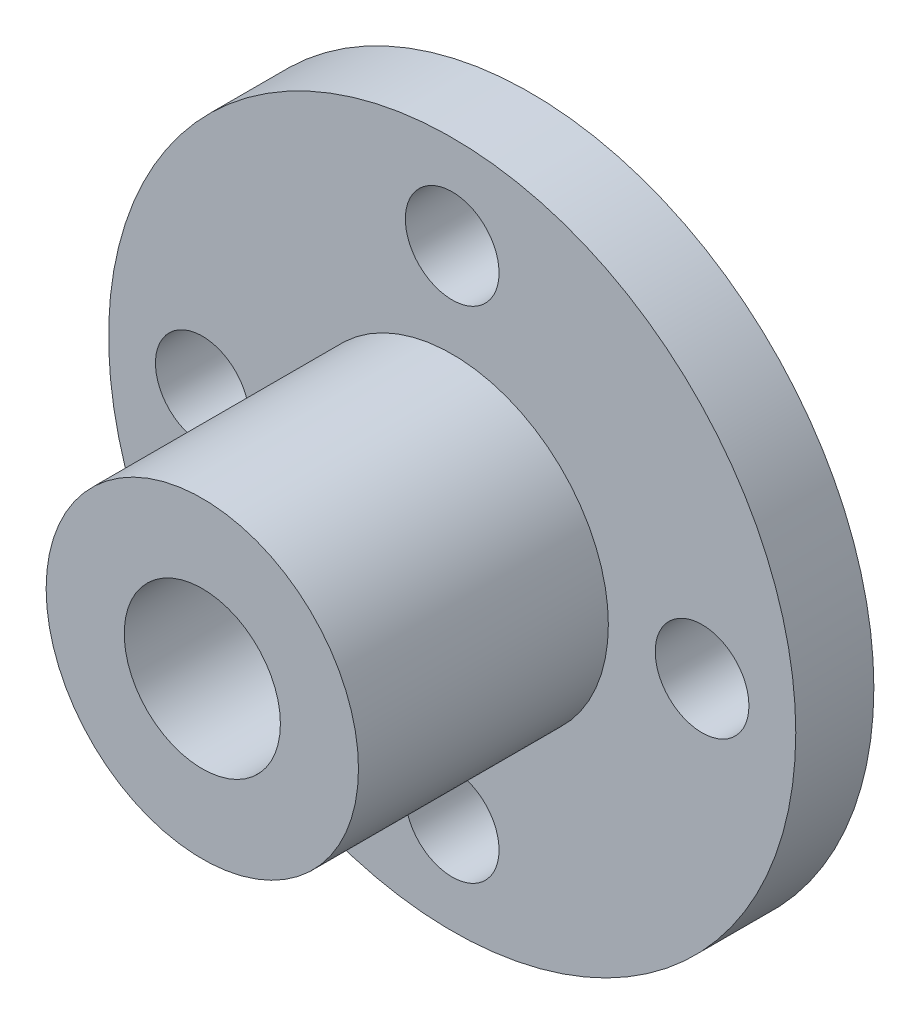
from build123d import *

# Parameters (mm, degrees)
SKETCH_1_R          = 11
EXTRUDE_1_DEPTH     = 2.5
SKETCH_2_R          = 5
EXTRUDE_2_DEPTH     = 8
CUT_EXTRUDE_1_REACH = 20.768
SKETCH_3_R          = 2.5
CUT_EXTRUDE_2_REACH = 19.493
SKETCH_4_R          = 1.5


with BuildPart() as part:
    # 草图1 → 凸台-拉伸1 (new body)
    with BuildSketch(Plane.XY):
        Circle(SKETCH_1_R)
    extrude(amount=EXTRUDE_1_DEPTH)

    # 草图2 → 凸台-拉伸2 (add)
    with BuildSketch(Plane.XY.offset(2.5)):
        Circle(SKETCH_2_R)
    extrude(amount=EXTRUDE_2_DEPTH)

    # 草图3 → 切除-拉伸1 (cut, up to next)
    with BuildSketch(Plane.XY.offset(10.5), mode=Mode.PRIVATE) as cut_extrude_1_sk1:
        Circle(SKETCH_3_R)
    cut_extrude_1_tool1 = extrude(cut_extrude_1_sk1.sketch, amount=-CUT_EXTRUDE_1_REACH, mode=Mode.PRIVATE) & part.part
    add(cut_extrude_1_tool1.solids().sort_by_distance((0, 0, 10.5))[0], mode=Mode.SUBTRACT)

    # 草图4 → 切除-拉伸2 (cut, up to next)
    with BuildSketch(Plane.XY.offset(2.5), mode=Mode.PRIVATE) as cut_extrude_2_sk1:
        with Locations((8, 0)):
            Circle(SKETCH_4_R)
    cut_extrude_2_tool1 = extrude(cut_extrude_2_sk1.sketch, amount=-CUT_EXTRUDE_2_REACH, mode=Mode.PRIVATE) & part.part
    # 草图4 → 切除-拉伸2 (cut, up to next)
    with BuildSketch(Plane.XY.offset(2.5), mode=Mode.PRIVATE) as cut_extrude_2_sk2:
        with Locations((0, -8)):
            Circle(SKETCH_4_R)
    cut_extrude_2_tool2 = extrude(cut_extrude_2_sk2.sketch, amount=-CUT_EXTRUDE_2_REACH, mode=Mode.PRIVATE) & part.part
    # 草图4 → 切除-拉伸2 (cut, up to next)
    with BuildSketch(Plane.XY.offset(2.5), mode=Mode.PRIVATE) as cut_extrude_2_sk3:
        with Locations((-8, 0)):
            Circle(SKETCH_4_R)
    cut_extrude_2_tool3 = extrude(cut_extrude_2_sk3.sketch, amount=-CUT_EXTRUDE_2_REACH, mode=Mode.PRIVATE) & part.part
    # 草图4 → 切除-拉伸2 (cut, up to next)
    with BuildSketch(Plane.XY.offset(2.5), mode=Mode.PRIVATE) as cut_extrude_2_sk4:
        with Locations((0, 8)):
            Circle(SKETCH_4_R)
    cut_extrude_2_tool4 = extrude(cut_extrude_2_sk4.sketch, amount=-CUT_EXTRUDE_2_REACH, mode=Mode.PRIVATE) & part.part
    add(cut_extrude_2_tool1.solids().sort_by_distance((8, 0, 2.5))[0], mode=Mode.SUBTRACT)
    add(cut_extrude_2_tool2.solids().sort_by_distance((0, -8, 2.5))[0], mode=Mode.SUBTRACT)
    add(cut_extrude_2_tool3.solids().sort_by_distance((-8, 0, 2.5))[0], mode=Mode.SUBTRACT)
    add(cut_extrude_2_tool4.solids().sort_by_distance((0, 8, 2.5))[0], mode=Mode.SUBTRACT)


solid = part.part
